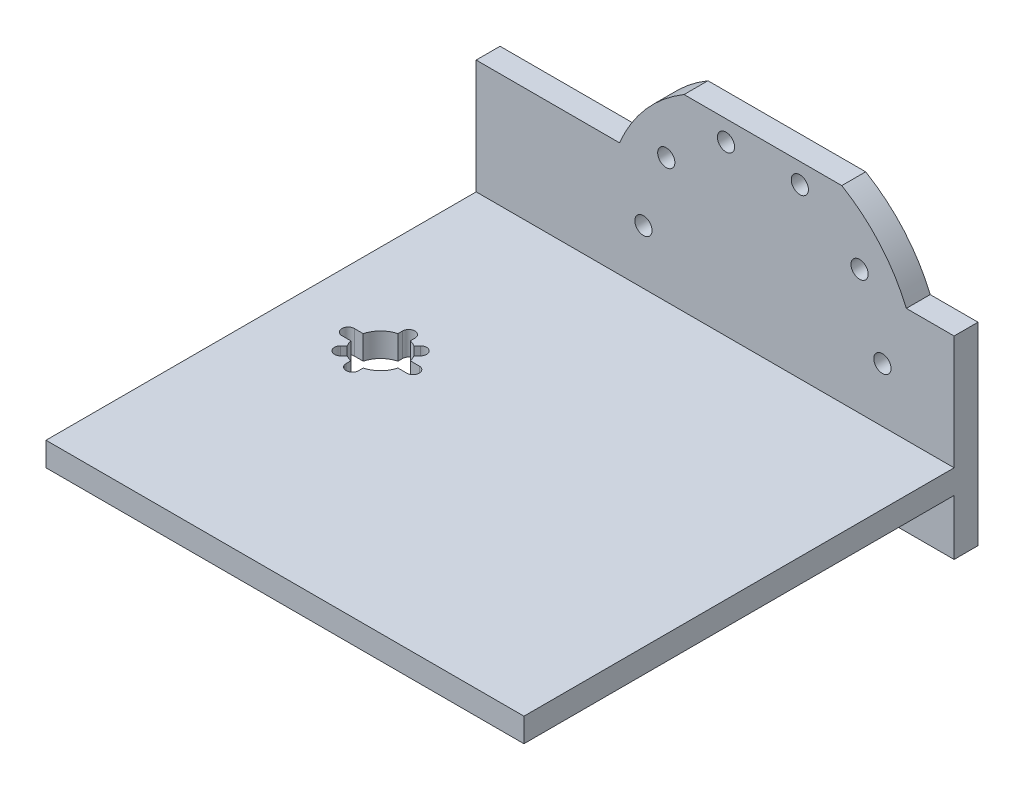
from build123d import *

# Parameters (mm, degrees)
SKETCH2_R           = 1.8
BOSS_EXTRUDE1_DEPTH = 5
SKETCH3_R           = 1.8
BOSS_EXTRUDE2_DEPTH = 5
BOSS_EXTRUDE3_DEPTH = 90
SKETCH5_R           = 0.927
CUT_EXTRUDE3_DEPTH  = 90
CUT_EXTRUDE4_DEPTH  = 90


with BuildPart() as part:
    # Sketch2 → Boss-Extrude1 (new body)
    with BuildSketch(Plane.XY):
        with BuildLine():
            ThreePointArc((30, 52.5), (24.507651866, 61.345374206), (16.5, 68))
            Line((16.5, 68), (-16.5, 68))
            ThreePointArc((-16.5, 68), (-24.507651866, 61.345374206), (-30, 52.5))
            Line((-30, 52.5), (-60, 52.5))
            Line((-60, 52.5), (-60, 12))
            Line((-60, 12), (40, 12))
            Line((40, 12), (40, 52.5))
            Line((40, 52.5), (30, 52.5))
        make_face()
        with Locations((-20.225424859, 25.305368693)):
            Circle(SKETCH2_R, mode=Mode.SUBTRACT)
        with Locations((-25, 40)):
            Circle(SKETCH2_R, mode=Mode.SUBTRACT)
        with Locations((-7.725424859, 16.223587093)):
            Circle(SKETCH2_R, mode=Mode.SUBTRACT)
        with Locations((7.725424859, 16.223587093)):
            Circle(SKETCH2_R, mode=Mode.SUBTRACT)
        with Locations((20.225424859, 25.305368693)):
            Circle(SKETCH2_R, mode=Mode.SUBTRACT)
        with Locations((25, 40)):
            Circle(SKETCH2_R, mode=Mode.SUBTRACT)
        with Locations((-20.225424859, 54.694631307)):
            Circle(SKETCH2_R, mode=Mode.SUBTRACT)
        with Locations((-7.725424859, 63.776412907)):
            Circle(SKETCH2_R, mode=Mode.SUBTRACT)
        with Locations((7.725424859, 63.776412907)):
            Circle(SKETCH2_R, mode=Mode.SUBTRACT)
        with Locations((20.225424859, 54.694631307)):
            Circle(SKETCH2_R, mode=Mode.SUBTRACT)
    extrude(amount=-BOSS_EXTRUDE1_DEPTH)

    # Sketch3 → Boss-Extrude2 (add)
    with BuildSketch(Plane.XY):
        with Locations((-20.225424859, 25.305368693)):
            Circle(SKETCH3_R)
        with Locations((20.225424859, 25.305368693)):
            Circle(SKETCH3_R)
    extrude(amount=-BOSS_EXTRUDE2_DEPTH)

    # Sketch4 → Boss-Extrude3 (add)
    with BuildSketch(Plane.XY):
        Polygon((15.062255845, 23.611), (32.664455845, 23.611), (40, 23.611), (40, 28.611), (-60, 28.611), (-60, 23.611), align=None)
    extrude(amount=BOSS_EXTRUDE3_DEPTH)

    # Sketch5 → Cut-Extrude3 (cut)
    with BuildSketch(Plane(origin=(0, 28.611, 0), x_dir=(1, 0, 0), z_dir=(0, 1, 0))):
        with BuildLine():
            Line((-40.197151893, -34.106422162), (-40.197151893, -32.9083))
            ThreePointArc((-40.197151893, -32.9083), (-41.197151893, -31.9083), (-42.197151893, -32.9083))
            Line((-42.197151893, -32.9083), (-42.197151893, -34.106422162))
            ThreePointArc((-42.197151893, -34.106422162), (-44.591264443, -35.40698745), (-45.891829731, -37.8011))
            Line((-45.891829731, -37.8011), (-47.991651893, -37.8011))
            ThreePointArc((-47.991651893, -37.8011), (-48.991651893, -38.8011), (-47.991651893, -39.8011))
            Line((-47.991651893, -39.8011), (-45.891829731, -39.8011))
            ThreePointArc((-45.891829731, -39.8011), (-45.631773649, -40.637980475), (-45.223897209, -41.413631753))
            Line((-45.223897209, -41.413631753), (-46.071097514, -42.260832059))
            ThreePointArc((-46.071097514, -42.260832059), (-46.071097514, -43.675045621), (-44.656883952, -43.675045621))
            Line((-44.656883952, -43.675045621), (-43.809683646, -42.827845316))
            ThreePointArc((-43.809683646, -42.827845316), (-43.034032368, -43.235721756), (-42.197151893, -43.495777838))
            Line((-42.197151893, -43.495777838), (-42.197151893, -44.6939))
            ThreePointArc((-42.197151893, -44.6939), (-41.197151893, -45.6939), (-40.197151893, -44.6939))
            Line((-40.197151893, -44.6939), (-40.197151893, -43.495777838))
            ThreePointArc((-40.197151893, -43.495777838), (-37.803039343, -42.19521255), (-36.502474055, -39.8011))
            Line((-36.502474055, -39.8011), (-34.402651893, -39.8011))
            ThreePointArc((-34.402651893, -39.8011), (-33.402651893, -38.8011), (-34.402651893, -37.8011))
            Line((-34.402651893, -37.8011), (-36.502474055, -37.8011))
            ThreePointArc((-36.502474055, -37.8011), (-36.762530137, -36.964219525), (-37.170406577, -36.188568247))
            Line((-37.170406577, -36.188568247), (-36.323206271, -35.341367941))
            ThreePointArc((-36.323206271, -35.341367941), (-36.323206271, -33.927154379), (-37.737419834, -33.927154379))
            Line((-37.737419834, -33.927154379), (-38.584620139, -34.774354684))
            ThreePointArc((-38.584620139, -34.774354684), (-39.360271417, -34.366478244), (-40.197151893, -34.106422162))
        make_face()
        with Locations((-41.197151893, -32.9083)):
            Circle(SKETCH5_R, mode=Mode.SUBTRACT)
        with BuildLine():
            ThreePointArc((-45.584634087, -37.8011), (-44.379132408, -35.619119485), (-42.197151893, -34.413617806))
            Line((-42.197151893, -34.413617806), (-42.197151893, -37.8011))
            Line((-42.197151893, -37.8011), (-45.584634087, -37.8011))
        make_face(mode=Mode.SUBTRACT)
        with BuildLine():
            ThreePointArc((-40.197151893, -34.413617806), (-39.475076447, -34.643642104), (-38.801840263, -34.991574807))
            Line((-38.801840263, -34.991574807), (-40.197151893, -36.386886438))
            Line((-40.197151893, -36.386886438), (-40.197151893, -34.413617806))
        make_face(mode=Mode.SUBTRACT)
        with BuildLine():
            Line((-45.584634087, -39.8011), (-43.611365455, -39.8011))
            Line((-43.611365455, -39.8011), (-45.006677086, -41.19641163))
            ThreePointArc((-45.006677086, -41.19641163), (-45.354609789, -40.523175446), (-45.584634087, -39.8011))
        make_face(mode=Mode.SUBTRACT)
        with BuildLine():
            ThreePointArc((-37.3876267, -36.40578837), (-37.039693997, -37.079024554), (-36.809669699, -37.8011))
            Line((-36.809669699, -37.8011), (-38.78293833, -37.8011))
            Line((-38.78293833, -37.8011), (-37.3876267, -36.40578837))
        make_face(mode=Mode.SUBTRACT)
        with Locations((-47.991651893, -38.8011)):
            Circle(SKETCH5_R, mode=Mode.SUBTRACT)
        with BuildLine():
            Line((-43.592463523, -42.610625193), (-42.197151893, -41.215313562))
            Line((-42.197151893, -41.215313562), (-42.197151893, -43.188582194))
            ThreePointArc((-42.197151893, -43.188582194), (-42.919227338, -42.958557896), (-43.592463523, -42.610625193))
        make_face(mode=Mode.SUBTRACT)
        with BuildLine():
            ThreePointArc((-36.809669699, -39.8011), (-38.015171378, -41.983080515), (-40.197151893, -43.188582194))
            Line((-40.197151893, -43.188582194), (-40.197151893, -39.8011))
            Line((-40.197151893, -39.8011), (-36.809669699, -39.8011))
        make_face(mode=Mode.SUBTRACT)
        with Locations((-34.402651893, -38.8011)):
            Circle(SKETCH5_R, mode=Mode.SUBTRACT)
        with Locations((-41.197151893, -44.6939)):
            Circle(SKETCH5_R, mode=Mode.SUBTRACT)
    extrude(amount=-CUT_EXTRUDE3_DEPTH, mode=Mode.SUBTRACT)


with BuildPart() as cut_extrude3_kept_piece:
    # of the separate pieces the step leaves, the one the design keeps (cut_extrude3_pieces_kept)
    add(part.part.solids().sort_by_distance((30, 52.5, 0))[0])

    # Sketch6 → Cut-Extrude4 (cut)
    with BuildSketch(Plane(origin=(0, 28.611, 0), x_dir=(1, 0, 0), z_dir=(0, 1, 0))):
        with BuildLine():
            Line((-37.949551868, -33.715022344), (-38.629271554, -34.39474203))
            ThreePointArc((-38.629271554, -34.39474203), (-39.245466388, -34.089314384), (-39.897151893, -33.869568798))
            Line((-39.897151893, -33.869568798), (-39.897151893, -32.9083))
            ThreePointArc((-39.897151893, -32.9083), (-41.197151893, -31.6083), (-42.497151893, -32.9083))
            Line((-42.497151893, -32.9083), (-42.497151893, -33.869568798))
            ThreePointArc((-42.497151893, -33.869568798), (-44.803396477, -35.194855416), (-46.128683095, -37.5011))
            Line((-46.128683095, -37.5011), (-47.991651893, -37.5011))
            ThreePointArc((-47.991651893, -37.5011), (-49.291651893, -38.8011), (-47.991651893, -40.1011))
            Line((-47.991651893, -40.1011), (-46.128683095, -40.1011))
            ThreePointArc((-46.128683095, -40.1011), (-45.908937509, -40.752785505), (-45.603509863, -41.368980339))
            Line((-45.603509863, -41.368980339), (-46.283229549, -42.048700025))
            ThreePointArc((-46.283229549, -42.048700025), (-46.283229549, -43.887177656), (-44.444751917, -43.887177656))
            Line((-44.444751917, -43.887177656), (-43.765032232, -43.20745797))
            ThreePointArc((-43.765032232, -43.20745797), (-43.148837398, -43.512885616), (-42.497151893, -43.732631202))
            Line((-42.497151893, -43.732631202), (-42.497151893, -44.6939))
            ThreePointArc((-42.497151893, -44.6939), (-41.197151893, -45.9939), (-39.897151893, -44.6939))
            Line((-39.897151893, -44.6939), (-39.897151893, -43.732631202))
            ThreePointArc((-39.897151893, -43.732631202), (-37.590907309, -42.407344584), (-36.26562069, -40.1011))
            Line((-36.26562069, -40.1011), (-34.402651893, -40.1011))
            ThreePointArc((-34.402651893, -40.1011), (-33.102651893, -38.8011), (-34.402651893, -37.5011))
            Line((-34.402651893, -37.5011), (-36.26562069, -37.5011))
            ThreePointArc((-36.26562069, -37.5011), (-36.485366277, -36.849414495), (-36.790793922, -36.233219661))
            Line((-36.790793922, -36.233219661), (-36.111074237, -35.553499975))
            ThreePointArc((-36.111074237, -35.553499975), (-36.111074237, -33.715022344), (-37.949551868, -33.715022344))
        make_face()
        with BuildLine():
            Line((-37.737419834, -33.927154379), (-38.584620139, -34.774354684))
            ThreePointArc((-38.584620139, -34.774354684), (-39.360271417, -34.366478244), (-40.197151893, -34.106422162))
            Line((-40.197151893, -34.106422162), (-40.197151893, -32.9083))
            ThreePointArc((-40.197151893, -32.9083), (-41.197151893, -31.9083), (-42.197151893, -32.9083))
            Line((-42.197151893, -32.9083), (-42.197151893, -34.106422162))
            ThreePointArc((-42.197151893, -34.106422162), (-44.591264443, -35.40698745), (-45.891829731, -37.8011))
            Line((-45.891829731, -37.8011), (-47.991651893, -37.8011))
            ThreePointArc((-47.991651893, -37.8011), (-48.991651893, -38.8011), (-47.991651893, -39.8011))
            Line((-47.991651893, -39.8011), (-45.891829731, -39.8011))
            ThreePointArc((-45.891829731, -39.8011), (-45.631773649, -40.637980475), (-45.223897209, -41.413631753))
            Line((-45.223897209, -41.413631753), (-46.071097514, -42.260832059))
            ThreePointArc((-46.071097514, -42.260832059), (-46.071097514, -43.675045621), (-44.656883952, -43.675045621))
            Line((-44.656883952, -43.675045621), (-43.809683646, -42.827845316))
            ThreePointArc((-43.809683646, -42.827845316), (-43.034032368, -43.235721756), (-42.197151893, -43.495777838))
            Line((-42.197151893, -43.495777838), (-42.197151893, -44.6939))
            ThreePointArc((-42.197151893, -44.6939), (-41.197151893, -45.6939), (-40.197151893, -44.6939))
            Line((-40.197151893, -44.6939), (-40.197151893, -43.495777838))
            ThreePointArc((-40.197151893, -43.495777838), (-37.803039343, -42.19521255), (-36.502474055, -39.8011))
            Line((-36.502474055, -39.8011), (-34.402651893, -39.8011))
            ThreePointArc((-34.402651893, -39.8011), (-33.402651893, -38.8011), (-34.402651893, -37.8011))
            Line((-34.402651893, -37.8011), (-36.502474055, -37.8011))
            ThreePointArc((-36.502474055, -37.8011), (-36.762530137, -36.964219525), (-37.170406577, -36.188568247))
            Line((-37.170406577, -36.188568247), (-36.323206271, -35.341367941))
            ThreePointArc((-36.323206271, -35.341367941), (-36.323206271, -33.927154379), (-37.737419834, -33.927154379))
        make_face(mode=Mode.SUBTRACT)
    extrude(amount=-CUT_EXTRUDE4_DEPTH, mode=Mode.SUBTRACT)


solid = cut_extrude3_kept_piece.part
